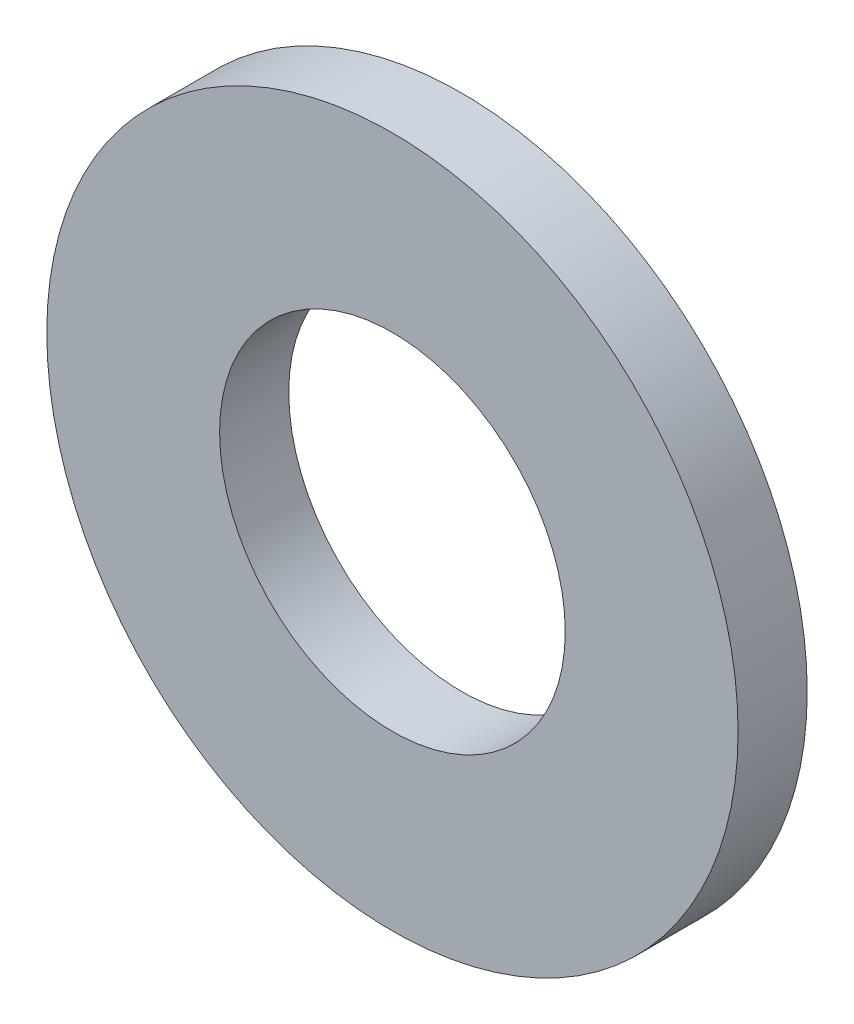
from build123d import *

# Parameters (mm, degrees)
SKETCH1_R           = 25
SKETCH1_R_2         = 12.5
BOSS_EXTRUDE1_DEPTH = 5


with BuildPart() as part:
    # Sketch1 → Boss-Extrude1 (new body)
    with BuildSketch(Plane.XY):
        Circle(SKETCH1_R)
        Circle(SKETCH1_R_2, mode=Mode.SUBTRACT)
    extrude(amount=BOSS_EXTRUDE1_DEPTH)


solid = part.part
